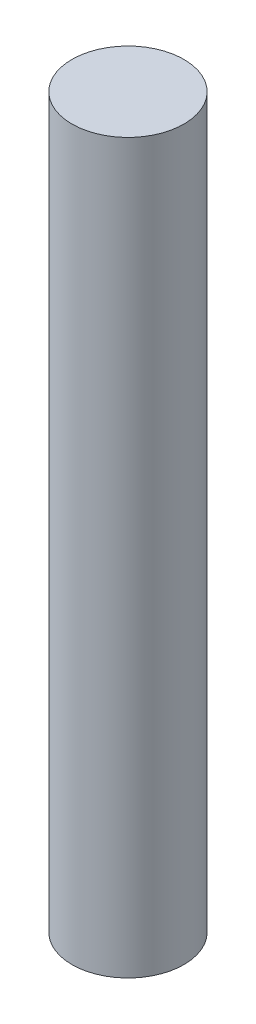
from build123d import *

# Parameters (mm, degrees)
SKETCH1_R           = 20
BOSS_EXTRUDE1_DEPTH = 260
SCALE1_SCALE        = 0.75


with BuildPart() as part:
    # Sketch1 → Boss-Extrude1 (new body)
    with BuildSketch(Plane(origin=(0, 0, 0), x_dir=(1, 0, 0), z_dir=(0, 1, 0))):
        with Locations(Location((0, 0, 0), (0, 0, 270))):
            Circle(SKETCH1_R)
    extrude(amount=BOSS_EXTRUDE1_DEPTH)


with BuildPart() as part_1:
    # Scale1: scaled about (0, 130, 0)
    add(part.part.scale(SCALE1_SCALE).moved(Location((0, 32.5, 0))))


solid = part_1.part
